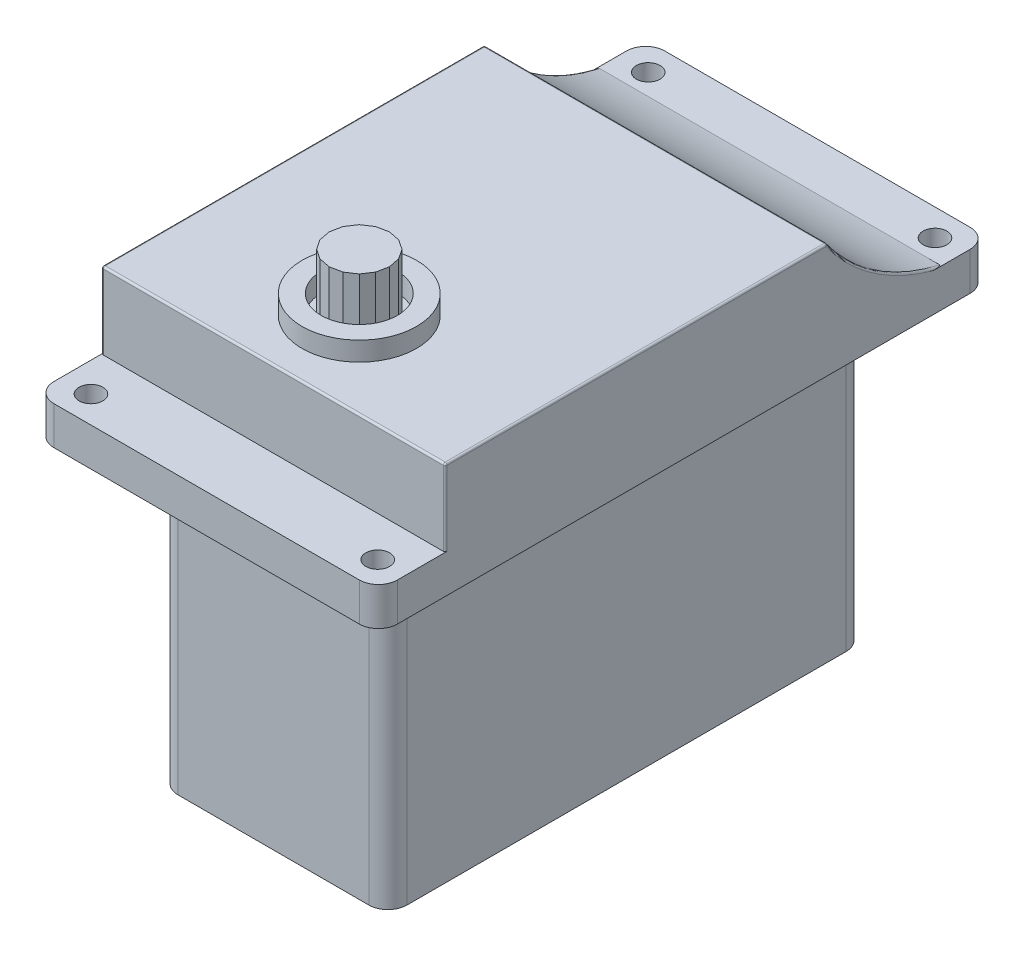
from build123d import *

# Parameters (mm, degrees)
BOSS_EXTRUDE1_DEPTH = 16
BOSS_EXTRUDE2_DEPTH = 2
BOSS_EXTRUDE3_DEPTH = 9
SKETCH5_R           = 0.622765991
CUT_EXTRUDE1_DEPTH  = 18
FILLET1_R           = 0.1
SKETCH6_R           = 3
SKETCH6_R_2         = 2
BOSS_EXTRUDE4_DEPTH = 1
BOSS_EXTRUDE5_DEPTH = 3


with BuildPart() as part:
    # Sketch1 → Boss-Extrude1 (new body)
    with BuildSketch(Plane(origin=(0, 0, 0), x_dir=(1, 0, 0), z_dir=(0, 1, 0))):
        with BuildLine():
            Line((-5, 12.5), (5, 12.5))
            ThreePointArc((5, 12.5), (5.707106781, 12.207106781), (6, 11.5))
            Line((6, 11.5), (6, -11.5))
            ThreePointArc((6, -11.5), (5.707106781, -12.207106781), (5, -12.5))
            Line((5, -12.5), (-5, -12.5))
            ThreePointArc((-5, -12.5), (-5.707106781, -12.207106781), (-6, -11.5))
            Line((-6, -11.5), (-6, 11.5))
            ThreePointArc((-6, 11.5), (-5.707106781, 12.207106781), (-5, 12.5))
        make_face()
    extrude(amount=BOSS_EXTRUDE1_DEPTH)

    # Sketch2 → Boss-Extrude2 (add)
    with BuildSketch(Plane(origin=(0, 16, 0), x_dir=(1, 0, 0), z_dir=(0, 1, 0))):
        with BuildLine():
            Line((-8, 16), (8, 16))
            ThreePointArc((8, 16), (8.707106781, 15.707106781), (9, 15))
            Line((9, 15), (9, -15))
            ThreePointArc((9, -15), (8.707106781, -15.707106781), (8, -16))
            Line((8, -16), (-8, -16))
            ThreePointArc((-8, -16), (-8.707106781, -15.707106781), (-9, -15))
            Line((-9, -15), (-9, 15))
            ThreePointArc((-9, 15), (-8.707106781, 15.707106781), (-8, 16))
        make_face()
    extrude(amount=BOSS_EXTRUDE2_DEPTH)

    # Sketch4 → Boss-Extrude3 (add, symmetric)
    with BuildSketch(Plane(origin=(0, 0, 0), x_dir=(0, 0, -1), z_dir=(1, 0, 0))):
        with BuildLine():
            Line((-12.5, 18), (13.5, 18))
            ThreePointArc((13.5, 18), (10.126897029, 19.440345543), (7.5, 22))
            Line((7.5, 22), (-12.5, 22))
            Line((-12.5, 22), (-12.5, 18))
        make_face()
    extrude(amount=BOSS_EXTRUDE3_DEPTH, both=True)

    # Sketch5 → Cut-Extrude1 (cut)
    with BuildSketch(Plane(origin=(0, 18, 0), x_dir=(1, 0, 0), z_dir=(0, 1, 0))):
        with Locations(Location((-7.460775455, -14.595038574, 0), (0, 0, 270))):
            Circle(SKETCH5_R)
        with Locations(Location((7.561200473, -14.595038574, 0), (0, 0, 270))):
            Circle(SKETCH5_R)
        with Locations(Location((-7.460775455, 14.59721935, 0), (0, 0, 270))):
            Circle(SKETCH5_R)
        with Locations(Location((7.561200473, 14.59721935, 0), (0, 0, 270))):
            Circle(SKETCH5_R)
    extrude(amount=-CUT_EXTRUDE1_DEPTH, mode=Mode.SUBTRACT)

    # Fillet1
    fillet1_edges = [part.edges().sort_by_distance(p)[0] for p in [
        (-9, 20, 12.5),
        (0, 22, 12.5),
        (-9, 19.440345543, -10.126897029),
        (-9, 22, 2.5),
        (0, 22, -7.5),
        (9, 20, 12.5),
        (9, 19.440345543, -10.126897029),
        (9, 22, 2.5),
    ]]
    fillet(fillet1_edges, radius=FILLET1_R)

    # Sketch6 → Boss-Extrude4 (add)
    with BuildSketch(Plane(origin=(0, 22, 0), x_dir=(1, 0, 0), z_dir=(0, 1, 0))):
        with Locations(Location((0, -8, 0), (0, 0, 90))):
            Circle(SKETCH6_R)
        with Locations(Location((0, -8, 0), (0, 0, 270))):
            Circle(SKETCH6_R_2, mode=Mode.SUBTRACT)
    extrude(amount=BOSS_EXTRUDE4_DEPTH)

    # Sketch7 → Boss-Extrude5 (add)
    with BuildSketch(Plane(origin=(0, 22, 0), x_dir=(1, 0, 0), z_dir=(0, 1, 0))):
        Polygon((-1.117847018, -6.882152982), (-1.460537515, -7.395025553), (-1.580874414, -8), (-1.460537515, -8.604974447), (-1.117847018, -9.117847018), (-0.604974447, -9.460537515), (0, -9.580874414), (0.604974447, -9.460537515), (1.117847018, -9.117847018), (1.460537515, -8.604974447), (1.580874414, -8), (1.460537515, -7.395025553), (1.117847018, -6.882152982), (0.604974447, -6.539462485), (0, -6.419125586), (-0.604974447, -6.539462485), align=None)
    extrude(amount=BOSS_EXTRUDE5_DEPTH)


solid = part.part
